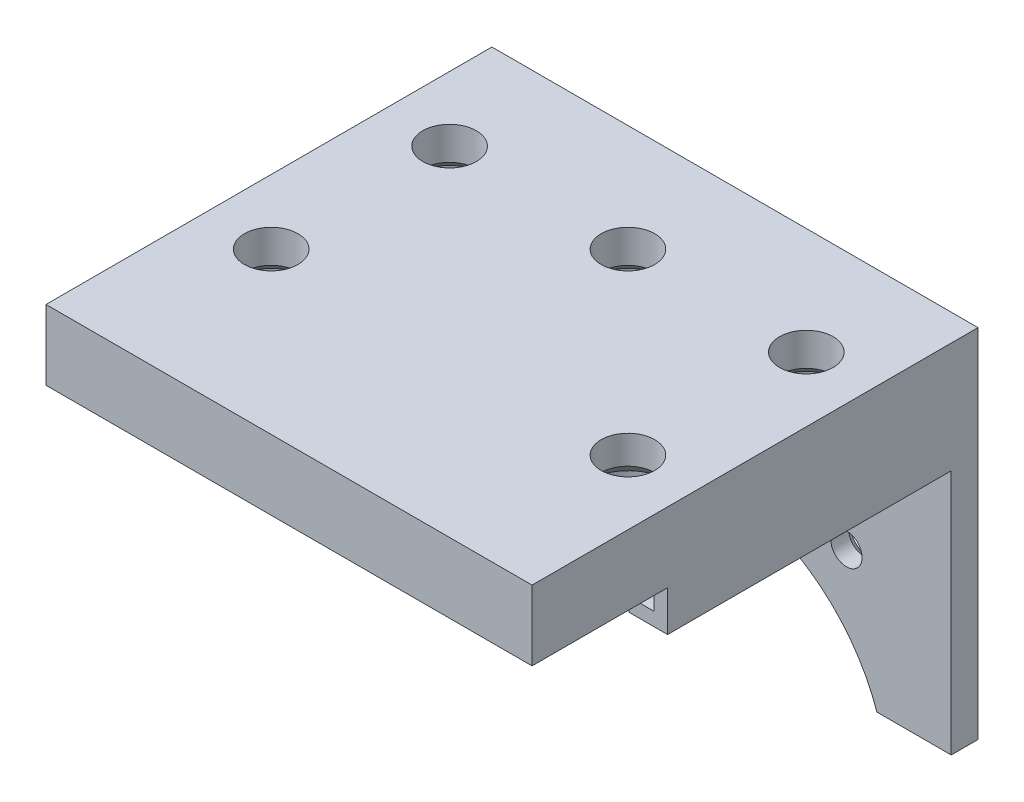
from build123d import *

# Parameters (mm, degrees)
CROQUIS1_W              = 54.5
CROQUIS1_H              = 35
SALIENTE_EXTRUIR1_DEPTH = 7.85
SALIENTE_EXTRUIR2_DEPTH = 35
CROQUIS3_W              = 54.5
CROQUIS3_H              = 7.85
SALIENTE_EXTRUIR3_DEPTH = 15
CROQUIS4_W              = 1.5
CROQUIS4_H              = 34.809371379
SALIENTE_EXTRUIR4_DEPTH = 4.55
CROQUIS5_W              = 34.809371379
CROQUIS5_H              = 1.5
SALIENTE_EXTRUIR5_DEPTH = 2.85
TALADRO1_AT_2_COUNT     = 2
TALADRO1_AT_2_PITCH     = 40
TALADRO1_AT_3_COUNT     = 2
TALADRO1_AT_3_PITCH     = 20
TALADRO1_AT_4_COUNT     = 2
TALADRO1_AT_4_PITCH     = 20
CHAFL_N1_SIZE           = 1
CROQUIS11_R             = 1.75
SALIENTE_EXTRUIR6_DEPTH = 3
CHAFL_N2_SIZE           = 1


with BuildPart() as part:
    # Croquis1 → Saliente-Extruir1 (new body)
    with BuildSketch(Plane.XZ.offset(-3.05)):
        with Locations((22.9, 8)):
            Rectangle(CROQUIS1_W, CROQUIS1_H)
    extrude(amount=-SALIENTE_EXTRUIR1_DEPTH)

    # Croquis2 → Saliente-Extruir2 (add)
    with BuildSketch(Plane.XY.offset(25.5)):
        Polygon((-4.35, 3.05), (-4.35, -1.5), (0, -1.5), (0, 0), (-2.85, 0), (-2.85, 3.05), align=None)
    extrude(amount=-SALIENTE_EXTRUIR2_DEPTH)

    # Croquis3 → Saliente-Extruir3 (add)
    with BuildSketch(Plane.XY.offset(25.5)):
        with Locations((22.9, 6.975)):
            Rectangle(CROQUIS3_W, CROQUIS3_H)
    extrude(amount=SALIENTE_EXTRUIR3_DEPTH)

    # Croquis4 → Saliente-Extruir4 (add)
    with BuildSketch(Plane.XZ.offset(-3.05)):
        with Locations((49.4, 7.90468569)):
            Rectangle(CROQUIS4_W, CROQUIS4_H)
    extrude(amount=SALIENTE_EXTRUIR4_DEPTH)

    # Croquis5 → Saliente-Extruir5 (add)
    with BuildSketch(Plane.ZY.offset(-48.65)):
        with Locations((7.90468569, -0.75)):
            Rectangle(CROQUIS5_W, CROQUIS5_H)
    extrude(amount=SALIENTE_EXTRUIR5_DEPTH)

    # Croquis7 → Taladro1 (revolve, cut)
    with BuildSketch(Plane(origin=(2.9, 3.05, 2.5), x_dir=(0, 0, -1), z_dir=(1, 0, 0))):
        Polygon((0, 0), (0, 7.85), (3, 7.85), (3, 3.15), (4.5, 3.15), (4.5, 0), align=None)
    taladro1 = revolve(axis=Axis((2.9, 113.05, 2.5), (0, -1, 0)), mode=Mode.SUBTRACT)

    # Taladro1 at 2: Taladro1 ×2
    with Locations(*[(i * TALADRO1_AT_2_PITCH, 0, 0) for i in range(1, TALADRO1_AT_2_COUNT)]):
        add(taladro1, mode=Mode.SUBTRACT)

    # Taladro1 at 3: Taladro1 ×2
    with Locations(*[(i * TALADRO1_AT_3_PITCH, 0, 0) for i in range(1, TALADRO1_AT_3_COUNT)]):
        add(taladro1, mode=Mode.SUBTRACT)

    # Taladro1 at 4: Taladro1 ×2
    with Locations(*[(0, 0, i * TALADRO1_AT_4_PITCH) for i in range(1, TALADRO1_AT_4_COUNT)]):
        add(taladro1, mode=Mode.SUBTRACT)

    # Croquis9 → Taladro2 (revolve, cut)
    with BuildSketch(Plane(origin=(42.9, 3.05, 22.5), x_dir=(0, 0, -1), z_dir=(1, 0, 0))):
        Polygon((0, 0), (0, 7.85), (3, 7.85), (3, 4.65), (4.5, 3.15), (4.5, 0), align=None)
    revolve(axis=Axis((42.9, -3.080023899, 22.5), (0, 1, 0)), mode=Mode.SUBTRACT)

    # Chaflán1
    chafl_n1_edges = [part.edges().sort_by_distance(p)[0] for p in [
        (2.9, 6.2, 25.5),
        (22.9, 6.2, 5.5),
        (42.9, 6.2, 5.5),
        (2.9, 6.2, 5.5),
    ]]
    chamfer(chafl_n1_edges, length=CHAFL_N1_SIZE)

    # Croquis11 → Saliente-Extruir6 (add)
    with BuildSketch(Plane(origin=(0, 0, -9.5), x_dir=(-1, 0, 0), z_dir=(0, 0, -1))):
        with BuildLine():
            Line((-50.15, 10.9), (4.35, 10.9))
            Line((4.35, 10.9), (4.35, -29.1))
            Line((4.35, -29.1), (-3.985719681, -29.1))
            ThreePointArc((-3.985719681, -29.1), (-22.9, -15.6), (-41.814280319, -29.1))
            Line((-41.814280319, -29.1), (-50.15, -29.1))
            Line((-50.15, -29.1), (-50.15, 10.9))
        make_face()
        with Locations((-38.4, -14.95)):
            Circle(CROQUIS11_R, mode=Mode.SUBTRACT)
        with Locations((-7.4, -14.95)):
            Circle(CROQUIS11_R, mode=Mode.SUBTRACT)
    extrude(amount=-SALIENTE_EXTRUIR6_DEPTH)

    # Chaflán2
    chafl_n2_edges = [part.edges().sort_by_distance(p)[0] for p in [
        (40.15, -14.95, -9.5),
        (9.15, -14.95, -9.5),
    ]]
    chamfer(chafl_n2_edges, length=CHAFL_N2_SIZE)


solid = part.part
